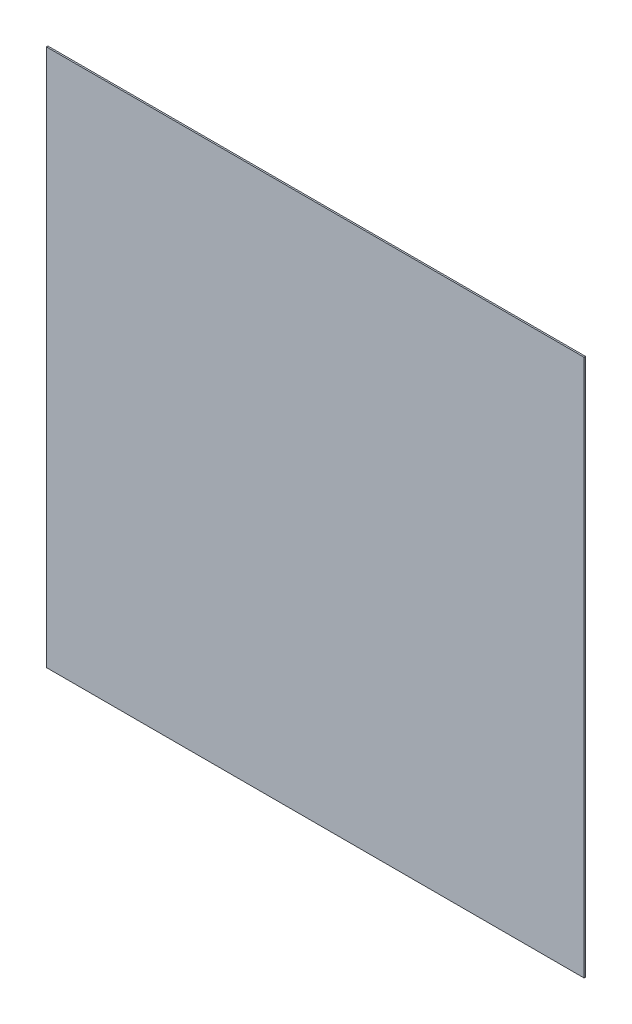
from build123d import *

# Parameters (mm, degrees)
SKETCH1_W           = 1800
SKETCH1_H           = 1800
BOSS_EXTRUDE1_DEPTH = 5


with BuildPart() as part:
    # Sketch1 → Boss-Extrude1 (new body)
    with BuildSketch(Plane.XY):
        Rectangle(SKETCH1_W, SKETCH1_H)
    extrude(amount=BOSS_EXTRUDE1_DEPTH)


solid = part.part
